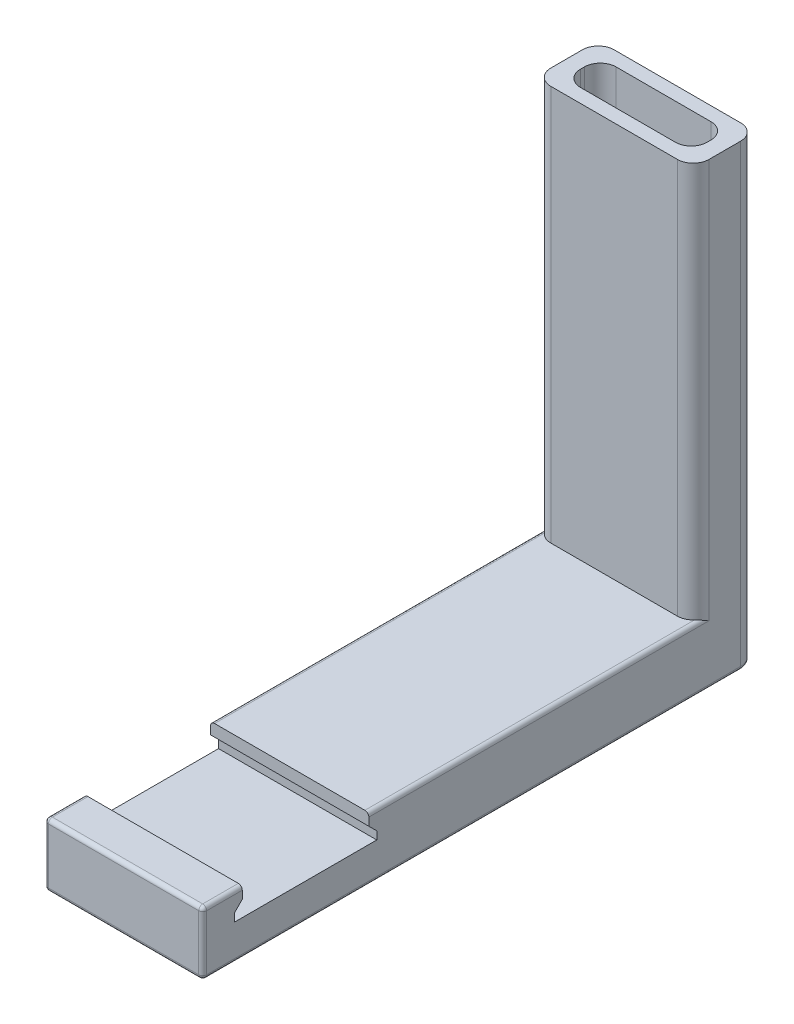
from build123d import *

# Parameters (mm, degrees)
SKETCH1_W           = 20
SKETCH1_H           = 8
BOSS_EXTRUDE2_DEPTH = 70
SKETCH3_W           = 20
SKETCH3_H           = 8
BOSS_EXTRUDE3_DEPTH = 50
SKETCH4_W           = 16
SKETCH4_H           = 4.5
CUT_EXTRUDE2_DEPTH  = 40
FILLET1_R           = 2
CUT_EXTRUDE3_DEPTH  = 28
FILLET3_R           = 0.5
FILLET4_R           = 2


with BuildPart() as part:
    # Sketch1 → Boss-Extrude2 (new body)
    with BuildSketch(Plane.XY):
        Rectangle(SKETCH1_W, SKETCH1_H)
    extrude(amount=BOSS_EXTRUDE2_DEPTH)

    # Sketch3 → Boss-Extrude3 (add)
    with BuildSketch(Plane(origin=(0, 4, 0), x_dir=(1, 0, 0), z_dir=(0, 1, 0))):
        with Locations((0, -4)):
            Rectangle(SKETCH3_W, SKETCH3_H)
    extrude(amount=BOSS_EXTRUDE3_DEPTH)

    # Sketch4 → Cut-Extrude2 (cut)
    with BuildSketch(Plane(origin=(0, 54, 0), x_dir=(1, 0, 0), z_dir=(0, 1, 0))):
        with Locations((0, -4)):
            Rectangle(SKETCH4_W, SKETCH4_H)
    extrude(amount=-CUT_EXTRUDE2_DEPTH, mode=Mode.SUBTRACT)

    # Fillet1
    fillet1_edges = [part.edges().sort_by_distance(p)[0] for p in [
        (-10, 29, 8),
        (10, 29, 8),
        (-10, 25, 0),
        (10, 25, 0),
    ]]
    fillet(fillet1_edges, radius=FILLET1_R)

    # Sketch5 → Cut-Extrude3 (cut)
    with BuildSketch(Plane.ZY.offset(10)):
        Polygon((65, 4), (65, 2.5), (66, 1.5), (66, 0.5), (48, 0.5), (48, 1.5), (49, 2.5), (49, 4), align=None)
    extrude(amount=-CUT_EXTRUDE3_DEPTH, mode=Mode.SUBTRACT)

    # Fillet3
    fillet3_edges = [part.edges().sort_by_distance(p)[0] for p in [
        (-10, 0, 70),
        (0, -4, 70),
        (0, -4, 0),
        (-9.414213562, -4, 0.585786438),
        (10, 0, 70),
        (9.414213562, -4, 0.585786438),
        (10, -4, 36),
        (-10, 4, 27.5),
        (-10, -4, 36),
        (-10, 4, 67.5),
        (10, 4, 67.5),
        (10, 4, 27.5),
        (0, 4, 70),
    ]]
    fillet(fillet3_edges, radius=FILLET3_R)

    # Fillet4
    fillet4_edges = [part.edges().sort_by_distance(p)[0] for p in [
        (8, 34, 1.75),
        (8, 34, 6.25),
        (-8, 34, 6.25),
        (-8, 34, 1.75),
    ]]
    fillet(fillet4_edges, radius=FILLET4_R)


solid = part.part
